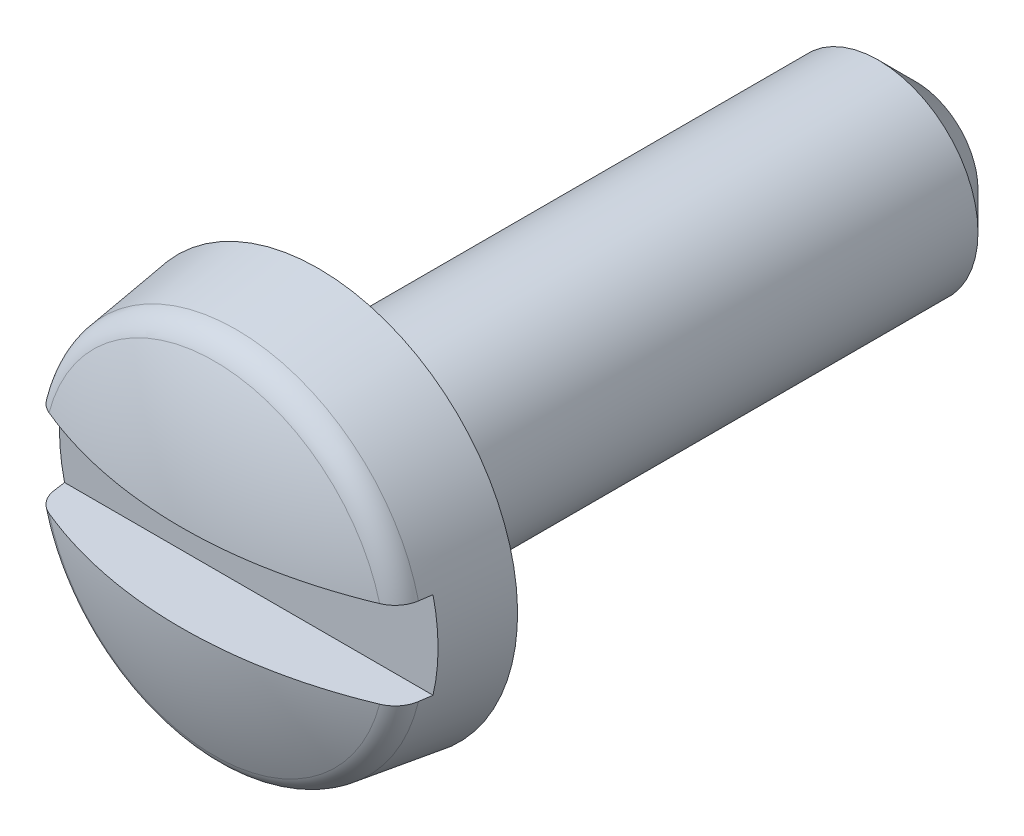
from build123d import *

# Parameters (mm, degrees)
SKETCH1_R       = 1
EXTRUDE3_DEPTH  = 0.7
SKETCH4_W       = 3
SKETCH4_H       = 0.5
CHAMFER2_SIZE   = 0.1875
SKETCH32_W      = 2
SKETCH32_H      = 0.4375
EXTRUDE16_DEPTH = 0.35


with BuildPart() as part:
    # Sketch1 → Extrude3 (new body)
    with BuildSketch(Plane.XY):
        Circle(SKETCH1_R)
    extrude(amount=EXTRUDE3_DEPTH)

    # Sketch11 → Cut-Revolve3 (revolve, cut)
    with BuildSketch(Plane(origin=(0, 0, 0), x_dir=(0, 0, -1), z_dir=(1, 0, 0))):
        with BuildLine():
            Line((-0.954, 1.04), (0, 1.04))
            Line((0, 1.04), (0, 1))
            Line((0, 1), (-0.413759684, 0.941849869))
            ThreePointArc((-0.413759684, 0.941849869), (-0.479195277, 0.91451653), (-0.522842313, 0.858624987))
            ThreePointArc((-0.522842313, 0.858624987), (-0.655248992, 0.438355368), (-0.7, 0))
            Line((-0.7, 0), (-0.954, 0))
            Line((-0.954, 0), (-0.954, 1.04))
        make_face()
    revolve(axis=Axis((0, 0, 0), (0, 0, 1)), mode=Mode.SUBTRACT)

    # Sketch32 → Extrude16 (cut)
    with BuildSketch(Plane.XY.offset(0.7)):
        Rectangle(SKETCH32_W, SKETCH32_H)
    extrude(amount=-EXTRUDE16_DEPTH, mode=Mode.SUBTRACT)


with BuildPart() as body_2:
    # Sketch4 → Revolve1 (revolve)
    with BuildSketch(Plane(origin=(0, 0, 0), x_dir=(0, 0, -1), z_dir=(1, 0, 0))):
        with Locations((1.5, 0.25)):
            Rectangle(SKETCH4_W, SKETCH4_H)
    revolve(axis=Axis((0, 0, 0), (0, 0, -1)))

    # Chamfer2
    chamfer2_edges = [body_2.edges().sort_by_distance(p)[0] for p in [
        (0, -0.5, -3),
    ]]
    chamfer(chamfer2_edges, length=CHAMFER2_SIZE)


solid = Compound([part.part, body_2.part])
